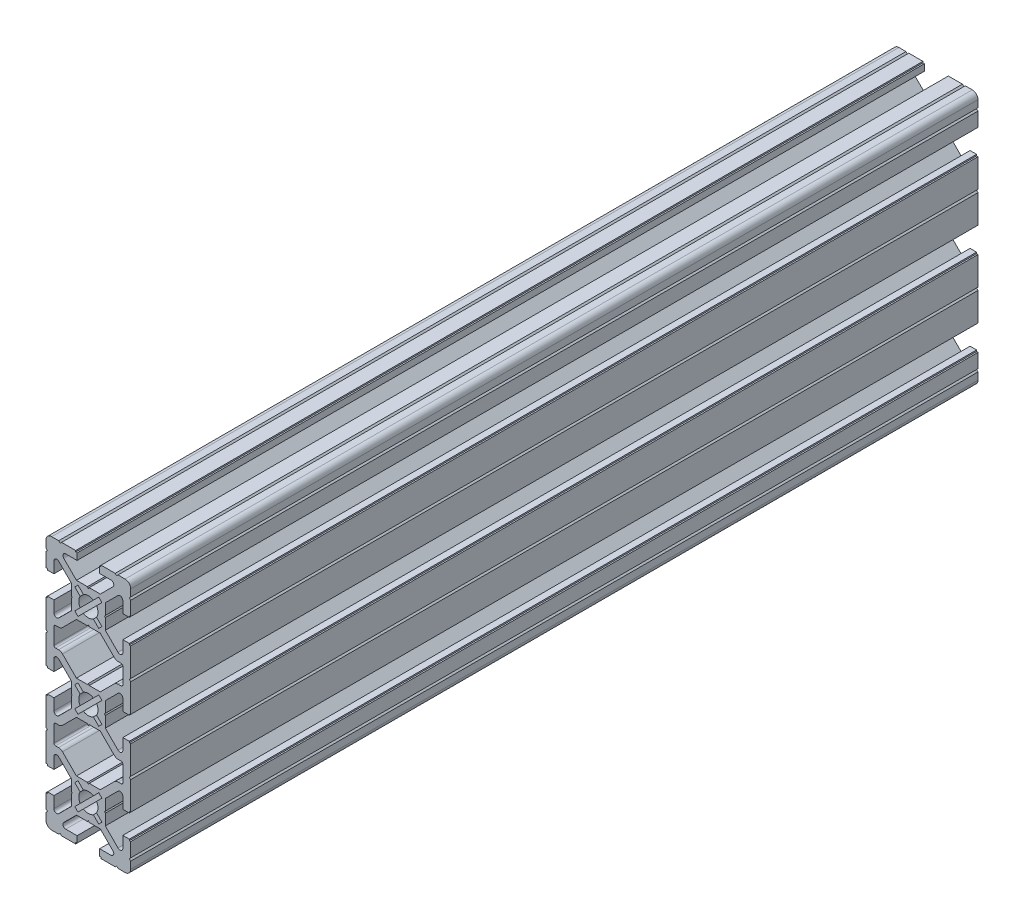
from build123d import *

# Parameters (mm, degrees)
BOSS_EXTRU_1_DEPTH = 300


with BuildPart() as part:
    # Esquisse1 → Boss.-Extru.1 (new body)
    with BuildSketch(Plane.XY):
        with BuildLine():
            Line((-5.7, 0), (-6, -0.312520901))
            Line((-6, -0.312520901), (-6, -4.214213564))
            Line((-6, -4.214213564), (-10.492893215, -8.70710678))
            ThreePointArc((-10.492893215, -8.70710678), (-11.582683434, -8.923879532), (-12.200000005, -7.999999995))
            Line((-12.200000005, -7.999999995), (-12.200000005, -4))
            Line((-12.200000005, -4), (-14.5, -4))
            Line((-14.5, -4), (-14.5, -4.5))
            Line((-14.5, -4.5), (-15, -4.5))
            Line((-15, -4.5), (-15, -14.499999999))
            Line((-15, -14.499999999), (-14.5, -14.999999999))
            Line((-14.5, -14.999999999), (-15, -15.499999999))
            Line((-15, -15.499999999), (-15, -25.5))
            Line((-15, -25.5), (-14.5, -25.5))
            Line((-14.5, -25.5), (-14.5, -26))
            Line((-14.5, -26), (-12.200000005, -26))
            Line((-12.200000005, -26), (-12.200000005, -22.000000006))
            ThreePointArc((-12.200000005, -22.000000006), (-11.582683434, -21.076120468), (-10.492893215, -21.292893221))
            Line((-10.492893215, -21.292893221), (-6, -25.785786436))
            Line((-6, -25.785786436), (-6, -29.687479097))
            Line((-6, -29.687479097), (-5.7, -30))
            Line((-5.7, -30), (-6, -30.312520901))
            Line((-6, -30.312520901), (-6, -34.214213564))
            Line((-6, -34.214213564), (-10.492893215, -38.70710678))
            ThreePointArc((-10.492893215, -38.70710678), (-11.582683434, -38.923879532), (-12.200000005, -37.999999995))
            Line((-12.200000005, -37.999999995), (-12.200000005, -34.000000001))
            Line((-12.200000005, -34.000000001), (-14.5, -34.000000001))
            Line((-14.5, -34.000000001), (-14.5, -34.5))
            Line((-14.5, -34.5), (-15, -34.5))
            Line((-15, -34.5), (-15, -39.500000001))
            Line((-15, -39.500000001), (-14.5, -40.000000001))
            Line((-14.5, -40.000000001), (-15, -40.500000001))
            Line((-15, -40.500000001), (-15, -43))
            ThreePointArc((-15, -43), (-14.414213562, -44.414213562), (-13, -45))
            Line((-13, -45), (-10.5, -45))
            Line((-10.5, -45), (-10.000000001, -44.500000001))
            Line((-10.000000001, -44.500000001), (-9.500000001, -45))
            Line((-9.500000001, -45), (-4.5, -45))
            Line((-4.5, -45), (-4.5, -44.5))
            Line((-4.5, -44.5), (-4, -44.5))
            Line((-4, -44.5), (-4, -42.200000005))
            Line((-4, -42.200000005), (-7.999999995, -42.200000005))
            ThreePointArc((-7.999999995, -42.200000005), (-8.923879532, -41.582683434), (-8.70710678, -40.492893215))
            Line((-8.70710678, -40.492893215), (-4.214213564, -36))
            Line((-4.214213564, -36), (-0.312520903, -36))
            Line((-0.312520903, -36), (0, -35.5))
            Line((0, -35.5), (0.312520901, -36))
            Line((0.312520901, -36), (4.214213564, -36))
            Line((4.214213564, -36), (8.70710678, -40.492893215))
            ThreePointArc((8.70710678, -40.492893215), (8.923879532, -41.582683434), (7.999999995, -42.200000005))
            Line((7.999999995, -42.200000005), (4, -42.200000005))
            Line((4, -42.200000005), (4, -44.5))
            Line((4, -44.5), (4.5, -44.5))
            Line((4.5, -44.5), (4.5, -45))
            Line((4.5, -45), (9.500000001, -45))
            Line((9.500000001, -45), (10.000000001, -44.500000001))
            Line((10.000000001, -44.500000001), (10.5, -45))
            Line((10.5, -45), (12.999999998, -45))
            ThreePointArc((12.999999998, -45), (14.41421356, -44.414213562), (14.999999998, -43))
            Line((14.999999998, -43), (14.999999998, -40.499999999))
            Line((14.999999998, -40.499999999), (14.5, -40.000000001))
            Line((14.5, -40.000000001), (14.999999998, -39.500000003))
            Line((14.999999998, -39.500000003), (14.999999998, -34.5))
            Line((14.999999998, -34.5), (14.5, -34.5))
            Line((14.5, -34.5), (14.5, -34.000000001))
            Line((14.5, -34.000000001), (12.200000005, -34.000000001))
            Line((12.200000005, -34.000000001), (12.200000005, -37.999999995))
            ThreePointArc((12.200000005, -37.999999995), (11.582683434, -38.923879532), (10.492893215, -38.70710678))
            Line((10.492893215, -38.70710678), (6, -34.214213564))
            Line((6, -34.214213564), (6, -30.312520903))
            Line((6, -30.312520903), (5.7, -30))
            Line((5.7, -30), (6, -29.687479099))
            Line((6, -29.687479099), (6, -25.785786436))
            Line((6, -25.785786436), (10.492893215, -21.29289322))
            ThreePointArc((10.492893215, -21.29289322), (11.582683434, -21.076120468), (12.200000005, -22.000000005))
            Line((12.200000005, -22.000000005), (12.200000005, -26))
            Line((12.200000005, -26), (14.5, -26))
            Line((14.5, -26), (14.5, -25.5))
            Line((14.5, -25.5), (14.999999998, -25.5))
            Line((14.999999998, -25.5), (14.999999998, -15.499999999))
            Line((14.999999998, -15.499999999), (14.499999998, -14.999999999))
            Line((14.499999998, -14.999999999), (14.999999998, -14.499999999))
            Line((14.999999998, -14.499999999), (14.999999998, -4.5))
            Line((14.999999998, -4.5), (14.5, -4.5))
            Line((14.5, -4.5), (14.5, -4))
            Line((14.5, -4), (12.200000005, -4))
            Line((12.200000005, -4), (12.200000005, -7.999999995))
            ThreePointArc((12.200000005, -7.999999995), (11.582683434, -8.923879532), (10.492893215, -8.707106779))
            Line((10.492893215, -8.707106779), (6, -4.214213564))
            Line((6, -4.214213564), (6, -0.312520903))
            Line((6, -0.312520903), (5.7, 0))
            Line((5.7, 0), (6, 0.312520903))
            Line((6, 0.312520903), (6, 4.214213564))
            Line((6, 4.214213564), (10.492893215, 8.707106779))
            ThreePointArc((10.492893215, 8.707106779), (11.582683434, 8.923879532), (12.200000005, 7.999999995))
            Line((12.200000005, 7.999999995), (12.200000005, 4))
            Line((12.200000005, 4), (14.5, 4))
            Line((14.5, 4), (14.5, 4.5))
            Line((14.5, 4.5), (14.999999998, 4.5))
            Line((14.999999998, 4.5), (14.999999998, 14.499999999))
            Line((14.999999998, 14.499999999), (14.499999998, 14.999999999))
            Line((14.499999998, 14.999999999), (14.999999998, 15.499999999))
            Line((14.999999998, 15.499999999), (14.999999998, 25.5))
            Line((14.999999998, 25.5), (14.5, 25.5))
            Line((14.5, 25.5), (14.5, 26))
            Line((14.5, 26), (12.200000005, 26))
            Line((12.200000005, 26), (12.200000005, 22.000000005))
            ThreePointArc((12.200000005, 22.000000005), (11.582683434, 21.076120468), (10.492893215, 21.29289322))
            Line((10.492893215, 21.29289322), (6, 25.785786436))
            Line((6, 25.785786436), (6, 29.687479099))
            Line((6, 29.687479099), (5.7, 30))
            Line((5.7, 30), (6, 30.312520903))
            Line((6, 30.312520903), (6, 34.214213564))
            Line((6, 34.214213564), (10.492893215, 38.70710678))
            ThreePointArc((10.492893215, 38.70710678), (11.582683434, 38.923879532), (12.200000005, 37.999999995))
            Line((12.200000005, 37.999999995), (12.200000005, 34.000000001))
            Line((12.200000005, 34.000000001), (14.5, 34.000000001))
            Line((14.5, 34.000000001), (14.5, 34.5))
            Line((14.5, 34.5), (14.999999998, 34.5))
            Line((14.999999998, 34.5), (14.999999998, 39.500000003))
            Line((14.999999998, 39.500000003), (14.5, 40.000000001))
            Line((14.5, 40.000000001), (14.999999998, 40.499999999))
            Line((14.999999998, 40.499999999), (14.999999998, 43))
            ThreePointArc((14.999999998, 43), (14.41421356, 44.414213562), (12.999999998, 45))
            Line((12.999999998, 45), (10.5, 45))
            Line((10.5, 45), (10.000000001, 44.500000001))
            Line((10.000000001, 44.500000001), (9.500000001, 45))
            Line((9.500000001, 45), (4.5, 45))
            Line((4.5, 45), (4.5, 44.5))
            Line((4.5, 44.5), (4, 44.5))
            Line((4, 44.5), (4, 42.200000005))
            Line((4, 42.200000005), (7.999999995, 42.200000005))
            ThreePointArc((7.999999995, 42.200000005), (8.923879532, 41.582683434), (8.70710678, 40.492893215))
            Line((8.70710678, 40.492893215), (4.214213564, 36))
            Line((4.214213564, 36), (0.312520901, 36))
            Line((0.312520901, 36), (0, 35.5))
            Line((0, 35.5), (-0.312520903, 36))
            Line((-0.312520903, 36), (-4.214213564, 36))
            Line((-4.214213564, 36), (-8.70710678, 40.492893215))
            ThreePointArc((-8.70710678, 40.492893215), (-8.923879532, 41.582683434), (-7.999999995, 42.200000005))
            Line((-7.999999995, 42.200000005), (-4, 42.200000005))
            Line((-4, 42.200000005), (-4, 44.5))
            Line((-4, 44.5), (-4.5, 44.5))
            Line((-4.5, 44.5), (-4.5, 45))
            Line((-4.5, 45), (-9.500000001, 45))
            Line((-9.500000001, 45), (-10.000000001, 44.500000001))
            Line((-10.000000001, 44.500000001), (-10.5, 45))
            Line((-10.5, 45), (-13, 45))
            ThreePointArc((-13, 45), (-14.414213562, 44.414213562), (-15, 43))
            Line((-15, 43), (-15, 40.500000001))
            Line((-15, 40.500000001), (-14.5, 40.000000001))
            Line((-14.5, 40.000000001), (-15, 39.500000001))
            Line((-15, 39.500000001), (-15, 34.5))
            Line((-15, 34.5), (-14.5, 34.5))
            Line((-14.5, 34.5), (-14.5, 34.000000001))
            Line((-14.5, 34.000000001), (-12.200000005, 34.000000001))
            Line((-12.200000005, 34.000000001), (-12.200000005, 37.999999995))
            ThreePointArc((-12.200000005, 37.999999995), (-11.582683434, 38.923879532), (-10.492893215, 38.70710678))
            Line((-10.492893215, 38.70710678), (-6, 34.214213564))
            Line((-6, 34.214213564), (-6, 30.312520901))
            Line((-6, 30.312520901), (-5.7, 30))
            Line((-5.7, 30), (-6, 29.687479097))
            Line((-6, 29.687479097), (-6, 25.785786436))
            Line((-6, 25.785786436), (-10.492893215, 21.292893221))
            ThreePointArc((-10.492893215, 21.292893221), (-11.582683434, 21.076120468), (-12.200000005, 22.000000006))
            Line((-12.200000005, 22.000000006), (-12.200000005, 26))
            Line((-12.200000005, 26), (-14.5, 26))
            Line((-14.5, 26), (-14.5, 25.5))
            Line((-14.5, 25.5), (-15, 25.5))
            Line((-15, 25.5), (-15, 15.499999999))
            Line((-15, 15.499999999), (-14.5, 14.999999999))
            Line((-14.5, 14.999999999), (-15, 14.499999999))
            Line((-15, 14.499999999), (-15, 4.5))
            Line((-15, 4.5), (-14.5, 4.5))
            Line((-14.5, 4.5), (-14.5, 4))
            Line((-14.5, 4), (-12.200000005, 4))
            Line((-12.200000005, 4), (-12.200000005, 7.999999995))
            ThreePointArc((-12.200000005, 7.999999995), (-11.582683434, 8.923879532), (-10.492893215, 8.70710678))
            Line((-10.492893215, 8.70710678), (-6, 4.214213564))
            Line((-6, 4.214213564), (-6, 0.312520901))
            Line((-6, 0.312520901), (-5.7, 0))
        make_face()
        with BuildLine():
            Line((2.902349714, -1.770978864), (4.808326112, -3.676955262))
            Line((4.808326112, -3.676955262), (3.676955262, -4.808326112))
            Line((3.676955262, -4.808326112), (1.770978864, -2.902349714))
            ThreePointArc((1.770978864, -2.902349714), (0, -3.4), (-1.770978864, -2.902349714))
            Line((-1.770978864, -2.902349714), (-3.676955262, -4.808326112))
            Line((-3.676955262, -4.808326112), (-4.808326112, -3.676955262))
            Line((-4.808326112, -3.676955262), (-2.902349714, -1.770978864))
            ThreePointArc((-2.902349714, -1.770978864), (-3.4, 0), (-2.902349714, 1.770978864))
            Line((-2.902349714, 1.770978864), (-4.808326112, 3.676955262))
            Line((-4.808326112, 3.676955262), (-3.676955262, 4.808326112))
            Line((-3.676955262, 4.808326112), (-1.770978864, 2.902349714))
            ThreePointArc((-1.770978864, 2.902349714), (0, 3.4), (1.770978864, 2.902349714))
            Line((1.770978864, 2.902349714), (3.676955262, 4.808326112))
            Line((3.676955262, 4.808326112), (4.808326112, 3.676955262))
            Line((4.808326112, 3.676955262), (2.902349714, 1.770978864))
            ThreePointArc((2.902349714, 1.770978864), (3.4, 0), (2.902349714, -1.770978864))
        make_face(mode=Mode.SUBTRACT)
        with BuildLine():
            Line((-2.902349714, -28.229021136), (-4.808326112, -26.323044738))
            Line((-4.808326112, -26.323044738), (-3.676955262, -25.191673888))
            Line((-3.676955262, -25.191673888), (-1.770978864, -27.097650286))
            ThreePointArc((-1.770978864, -27.097650286), (0, -26.6), (1.770978864, -27.097650286))
            Line((1.770978864, -27.097650286), (3.676955262, -25.191673888))
            Line((3.676955262, -25.191673888), (4.808326112, -26.323044738))
            Line((4.808326112, -26.323044738), (2.902349714, -28.229021136))
            ThreePointArc((2.902349714, -28.229021136), (3.4, -30), (2.902349714, -31.770978864))
            Line((2.902349714, -31.770978864), (4.808326112, -33.676955262))
            Line((4.808326112, -33.676955262), (3.676955262, -34.808326112))
            Line((3.676955262, -34.808326112), (1.770978864, -32.902349714))
            ThreePointArc((1.770978864, -32.902349714), (0, -33.4), (-1.770978864, -32.902349714))
            Line((-1.770978864, -32.902349714), (-3.676955262, -34.808326112))
            Line((-3.676955262, -34.808326112), (-4.808326112, -33.676955262))
            Line((-4.808326112, -33.676955262), (-2.902349714, -31.770978864))
            ThreePointArc((-2.902349714, -31.770978864), (-3.4, -30), (-2.902349714, -28.229021136))
        make_face(mode=Mode.SUBTRACT)
        with BuildLine():
            Line((-9.158427127, -10.944213562), (-4.214213564, -6))
            Line((-4.214213564, -6), (-0.312520901, -6))
            Line((-0.312520901, -6), (0, -6.469062005))
            Line((0, -6.469062005), (0.312520903, -6))
            Line((0.312520903, -6), (4.214213564, -6))
            Line((4.214213564, -6), (9.158427127, -10.944213562))
            ThreePointArc((9.158427127, -10.944213562), (9.807273824, -11.377759065), (10.572640689, -11.53))
            Line((10.572640689, -11.53), (11.600000005, -11.53))
            ThreePointArc((11.600000005, -11.53), (12.024264074, -11.705735931), (12.200000005, -12.13))
            Line((12.200000005, -12.13), (12.200000005, -17.87))
            ThreePointArc((12.200000005, -17.87), (12.024264074, -18.294264069), (11.600000005, -18.47))
            Line((11.600000005, -18.47), (10.572640689, -18.47))
            ThreePointArc((10.572640689, -18.47), (9.807273824, -18.622240935), (9.158427127, -19.055786438))
            Line((9.158427127, -19.055786438), (4.214213564, -24))
            Line((4.214213564, -24), (0.312520903, -24))
            Line((0.312520903, -24), (0, -24.5))
            Line((0, -24.5), (-0.312520901, -24))
            Line((-0.312520901, -24), (-4.214213564, -24))
            Line((-4.214213564, -24), (-9.158427127, -19.055786438))
            ThreePointArc((-9.158427127, -19.055786438), (-9.807273824, -18.622240935), (-10.572640689, -18.47))
            Line((-10.572640689, -18.47), (-11.600000005, -18.47))
            ThreePointArc((-11.600000005, -18.47), (-12.024264074, -18.294264069), (-12.200000005, -17.87))
            Line((-12.200000005, -17.87), (-12.200000005, -12.13))
            ThreePointArc((-12.200000005, -12.13), (-12.024264074, -11.705735931), (-11.600000005, -11.53))
            Line((-11.600000005, -11.53), (-10.572640689, -11.53))
            ThreePointArc((-10.572640689, -11.53), (-9.807273824, -11.377759065), (-9.158427127, -10.944213562))
        make_face(mode=Mode.SUBTRACT)
        with BuildLine():
            Line((-11.600000005, 11.53), (-10.572640689, 11.53))
            ThreePointArc((-10.572640689, 11.53), (-9.807273824, 11.377759065), (-9.158427127, 10.944213562))
            Line((-9.158427127, 10.944213562), (-4.214213564, 6))
            Line((-4.214213564, 6), (-0.312520901, 6))
            Line((-0.312520901, 6), (0, 6.469062005))
            Line((0, 6.469062005), (0.312520903, 6))
            Line((0.312520903, 6), (4.214213564, 6))
            Line((4.214213564, 6), (9.158427127, 10.944213562))
            ThreePointArc((9.158427127, 10.944213562), (9.807273824, 11.377759065), (10.572640689, 11.53))
            Line((10.572640689, 11.53), (11.600000005, 11.53))
            ThreePointArc((11.600000005, 11.53), (12.024264074, 11.705735931), (12.200000005, 12.13))
            Line((12.200000005, 12.13), (12.200000005, 17.87))
            ThreePointArc((12.200000005, 17.87), (12.024264074, 18.294264069), (11.600000005, 18.47))
            Line((11.600000005, 18.47), (10.572640689, 18.47))
            ThreePointArc((10.572640689, 18.47), (9.807273824, 18.622240935), (9.158427127, 19.055786438))
            Line((9.158427127, 19.055786438), (4.214213564, 24))
            Line((4.214213564, 24), (0.312520903, 24))
            Line((0.312520903, 24), (0, 24.5))
            Line((0, 24.5), (-0.312520901, 24))
            Line((-0.312520901, 24), (-4.214213564, 24))
            Line((-4.214213564, 24), (-9.158427127, 19.055786438))
            ThreePointArc((-9.158427127, 19.055786438), (-9.807273824, 18.622240935), (-10.572640689, 18.47))
            Line((-10.572640689, 18.47), (-11.600000005, 18.47))
            ThreePointArc((-11.600000005, 18.47), (-12.024264074, 18.294264069), (-12.200000005, 17.87))
            Line((-12.200000005, 17.87), (-12.200000005, 12.13))
            ThreePointArc((-12.200000005, 12.13), (-12.024264074, 11.705735931), (-11.600000005, 11.53))
        make_face(mode=Mode.SUBTRACT)
        with BuildLine():
            Line((-4.808326112, 33.676955262), (-2.902349714, 31.770978864))
            ThreePointArc((-2.902349714, 31.770978864), (-3.4, 30), (-2.902349714, 28.229021136))
            Line((-2.902349714, 28.229021136), (-4.808326112, 26.323044738))
            Line((-4.808326112, 26.323044738), (-3.676955262, 25.191673888))
            Line((-3.676955262, 25.191673888), (-1.770978864, 27.097650286))
            ThreePointArc((-1.770978864, 27.097650286), (0, 26.6), (1.770978864, 27.097650286))
            Line((1.770978864, 27.097650286), (3.676955262, 25.191673888))
            Line((3.676955262, 25.191673888), (4.808326112, 26.323044738))
            Line((4.808326112, 26.323044738), (2.902349714, 28.229021136))
            ThreePointArc((2.902349714, 28.229021136), (3.4, 30), (2.902349714, 31.770978864))
            Line((2.902349714, 31.770978864), (4.808326112, 33.676955262))
            Line((4.808326112, 33.676955262), (3.676955262, 34.808326112))
            Line((3.676955262, 34.808326112), (1.770978864, 32.902349714))
            ThreePointArc((1.770978864, 32.902349714), (0, 33.4), (-1.770978864, 32.902349714))
            Line((-1.770978864, 32.902349714), (-3.676955262, 34.808326112))
            Line((-3.676955262, 34.808326112), (-4.808326112, 33.676955262))
        make_face(mode=Mode.SUBTRACT)
    extrude(amount=BOSS_EXTRU_1_DEPTH)


solid = part.part
